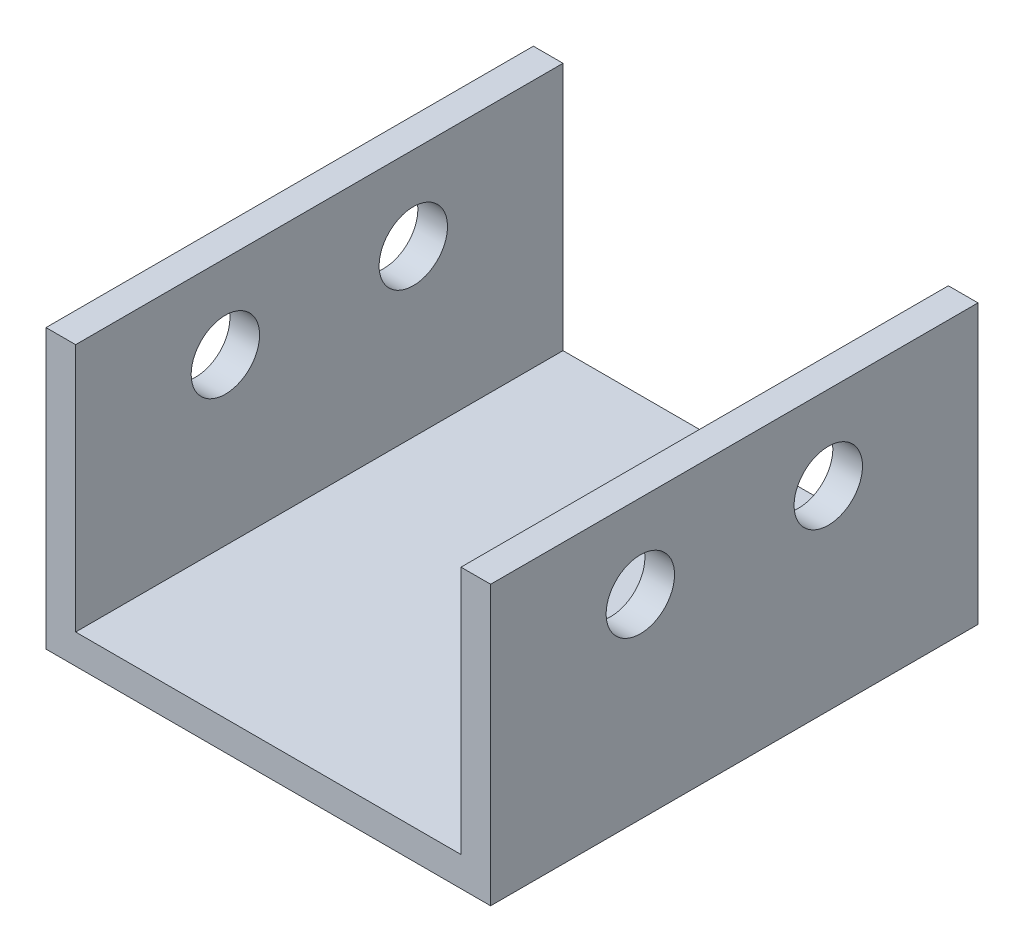
from build123d import *

# Parameters (mm, degrees)
BOSS_EXTRUDE1_DEPTH = 28.5
SKETCH2_R           = 4
CUT_EXTRUDE1_DEPTH  = 68.6546226


with BuildPart() as part:
    # Sketch1 → Boss-Extrude1 (new, symmetric)
    with BuildSketch(Plane.XY):
        Polygon((-26, 0), (26, 0), (26, 32.571428571), (22.533333333, 32.571428571), (22.533333333, 3.466666667), (-22.533333333, 3.466666667), (-22.533333333, 32.571428571), (-26, 32.571428571), align=None)
    extrude(amount=BOSS_EXTRUDE1_DEPTH, both=True)

    # Sketch2 → Cut-Extrude1 (cut, through all)
    with BuildSketch(Plane(origin=(26, 0, 0), x_dir=(0, 0, -1), z_dir=(1, 0, 0))):
        with Locations(Location((-10.99, 22.8, 0), (0, 0, 90))):
            Circle(SKETCH2_R)
        with Locations(Location((10.99, 22.8, 0), (0, 0, 270))):
            Circle(SKETCH2_R)
    extrude(amount=-CUT_EXTRUDE1_DEPTH, mode=Mode.SUBTRACT)


solid = part.part
